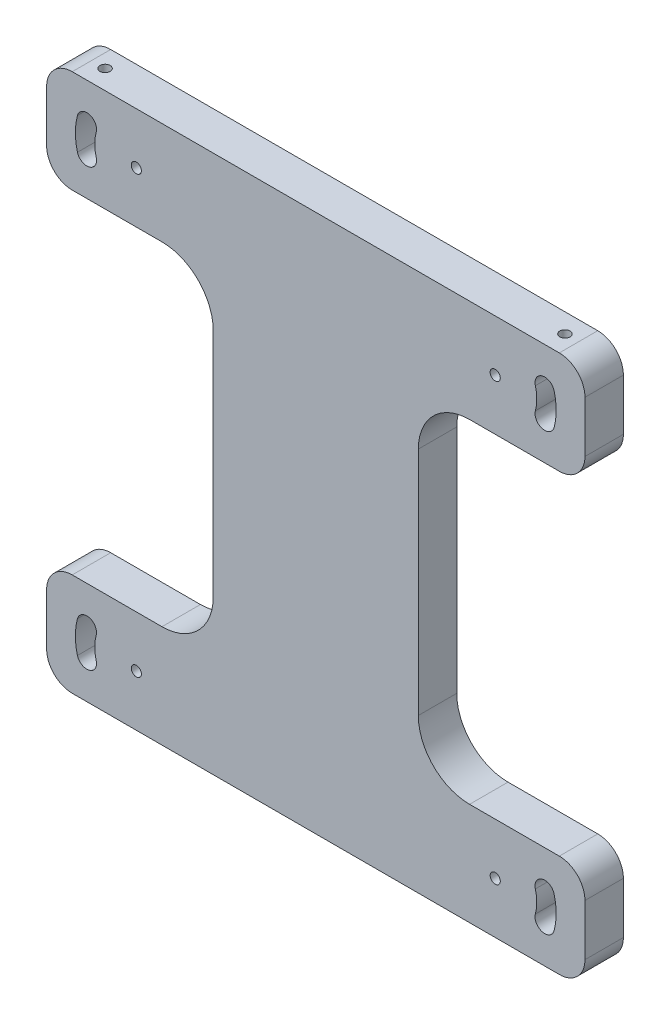
from build123d import *

# Parameters (mm, degrees)
MODEL_R             = 2.5146
BOSS_EXTRUDE1_DEPTH = 19.05
CUT_EXTRUDE1_REACH  = 439.02
SKETCH2_R           = 2.5527
CUT_EXTRUDE2_REACH  = 439.02
SKETCH3_R           = 2.5527


with BuildPart() as part:
    # Model → Boss-Extrude1 (new body)
    with BuildSketch(Plane.XY):
        with BuildLine():
            Line((332.980192528, 413.072749717), (91.680192525, 413.072749717))
            ThreePointArc((91.680192525, 413.072749717), (82.699936404, 409.353005838), (78.980192525, 400.372749717))
            Line((78.980192525, 400.372749717), (78.980192525, 374.972749717))
            ThreePointArc((78.980192525, 374.972749717), (82.699936404, 365.992493596), (91.680192525, 362.272749717))
            Line((91.680192525, 362.272749717), (136.130192525, 362.272749717))
            ThreePointArc((136.130192525, 362.272749717), (154.090704768, 354.833261959), (161.530192525, 336.872749717))
            Line((161.530192525, 336.872749717), (161.530192525, 222.572749717))
            ThreePointArc((161.530192525, 222.572749717), (154.090704768, 204.612237475), (136.130192525, 197.172749717))
            Line((136.130192525, 197.172749717), (91.680192525, 197.172749717))
            ThreePointArc((91.680192525, 197.172749717), (82.699936404, 193.453005838), (78.980192525, 184.472749717))
            Line((78.980192525, 184.472749717), (78.980192525, 159.072749717))
            ThreePointArc((78.980192525, 159.072749717), (82.699936404, 150.092493596), (91.680192525, 146.372749717))
            Line((91.680192525, 146.372749717), (332.980192528, 146.372749717))
            ThreePointArc((332.980192528, 146.372749717), (341.960448649, 150.092493596), (345.680192528, 159.072749717))
            Line((345.680192528, 159.072749717), (345.680192528, 184.472749717))
            ThreePointArc((345.680192528, 184.472749717), (341.960448648, 193.453005839), (332.980192525, 197.172749717))
            Line((332.980192525, 197.172749717), (288.530192525, 197.172749717))
            ThreePointArc((288.530192525, 197.172749717), (270.569680283, 204.612237475), (263.130192525, 222.572749717))
            Line((263.130192525, 222.572749717), (263.130192525, 336.872749717))
            ThreePointArc((263.130192525, 336.872749717), (270.569680284, 354.83326196), (288.530192528, 362.272749717))
            Line((288.530192528, 362.272749717), (332.980192528, 362.272749717))
            ThreePointArc((332.980192528, 362.272749717), (341.960448649, 365.992493596), (345.680192528, 374.972749717))
            Line((345.680192528, 374.972749717), (345.680192528, 400.372749717))
            ThreePointArc((345.680192528, 400.372749717), (341.960448649, 409.353005838), (332.980192528, 413.072749717))
        make_face()
        with Locations(Location((123.430192525, 387.672749717, 0), (0, 0, 180))):
            Circle(MODEL_R, mode=Mode.SUBTRACT)
        with Locations(Location((301.230192525, 387.672749717, 0), (0, 0, 180))):
            Circle(MODEL_R, mode=Mode.SUBTRACT)
        with Locations(Location((123.430192525, 171.772749717, 0), (0, 0, 180))):
            Circle(MODEL_R, mode=Mode.SUBTRACT)
        with Locations(Location((301.230192525, 171.772749717, 0), (0, 0, 180))):
            Circle(MODEL_R, mode=Mode.SUBTRACT)
        with BuildLine():
            ThreePointArc((330.402277638, 163.888053974), (331.440317525, 171.772749717), (330.402277638, 179.657445459))
            ThreePointArc((330.402277638, 179.657445459), (324.511101714, 183.058717465), (321.109829708, 177.167541541))
            ThreePointArc((321.109829708, 177.167541541), (321.820067525, 171.772749717), (321.109829708, 166.377957893))
            ThreePointArc((321.109829708, 166.377957893), (324.511101714, 160.486781969), (330.402277638, 163.888053974))
        make_face(mode=Mode.SUBTRACT)
        with BuildLine():
            ThreePointArc((103.550555343, 177.167541541), (102.840317525, 171.772749717), (103.550555343, 166.377957893))
            ThreePointArc((103.550555343, 166.377957893), (100.149283337, 160.486781969), (94.258107413, 163.888053974))
            ThreePointArc((94.258107413, 163.888053974), (93.220067525, 171.772749717), (94.258107413, 179.657445459))
            ThreePointArc((94.258107413, 179.657445459), (100.149283337, 183.058717465), (103.550555343, 177.167541541))
        make_face(mode=Mode.SUBTRACT)
        with BuildLine():
            ThreePointArc((321.109829708, 382.277957893), (321.820067525, 387.672749717), (321.109829708, 393.067541541))
            ThreePointArc((321.109829708, 393.067541541), (324.511101714, 398.958717465), (330.402277638, 395.557445459))
            ThreePointArc((330.402277638, 395.557445459), (331.440317525, 387.672749717), (330.402277638, 379.788053974))
            ThreePointArc((330.402277638, 379.788053974), (324.511101714, 376.386781969), (321.109829708, 382.277957893))
        make_face(mode=Mode.SUBTRACT)
        with BuildLine():
            ThreePointArc((94.258107413, 395.557445459), (93.220067525, 387.672749717), (94.258107413, 379.788053974))
            ThreePointArc((94.258107413, 379.788053974), (100.149283337, 376.386781969), (103.550555343, 382.277957893))
            ThreePointArc((103.550555343, 382.277957893), (102.840317525, 387.672749717), (103.550555343, 393.067541541))
            ThreePointArc((103.550555343, 393.067541541), (100.149283337, 398.958717465), (94.258107413, 395.557445459))
        make_face(mode=Mode.SUBTRACT)
    extrude(amount=BOSS_EXTRUDE1_DEPTH)

    # Sketch2 → Cut-Extrude1 (cut, up to next)
    with BuildSketch(Plane(origin=(0, 413.072749717, 0), x_dir=(1, 0, 0), z_dir=(0, 1, 0)), mode=Mode.PRIVATE) as cut_extrude1_sk1:
        with Locations(Location((98.411192525, -9.525, 0), (0, 0, 180))):
            Circle(SKETCH2_R)
    cut_extrude1_tool1 = extrude(cut_extrude1_sk1.sketch, amount=-CUT_EXTRUDE1_REACH, mode=Mode.PRIVATE) & part.part
    # Sketch2 → Cut-Extrude1 (cut, up to next)
    with BuildSketch(Plane(origin=(0, 413.072749717, 0), x_dir=(1, 0, 0), z_dir=(0, 1, 0)), mode=Mode.PRIVATE) as cut_extrude1_sk2:
        with Locations(Location((326.249192528, -9.525, 0), (0, 0, 180))):
            Circle(SKETCH2_R)
    cut_extrude1_tool2 = extrude(cut_extrude1_sk2.sketch, amount=-CUT_EXTRUDE1_REACH, mode=Mode.PRIVATE) & part.part
    add(cut_extrude1_tool1.solids().sort_by_distance((98.411193, 413.07275, 9.525))[0], mode=Mode.SUBTRACT)
    add(cut_extrude1_tool2.solids().sort_by_distance((326.249193, 413.07275, 9.525))[0], mode=Mode.SUBTRACT)

    # Sketch3 → Cut-Extrude2 (cut, up to next)
    with BuildSketch(Plane.XZ.offset(-146.372749717), mode=Mode.PRIVATE) as cut_extrude2_sk1:
        with Locations(Location((98.411192525, 9.525, 0), (0, 0, 180))):
            Circle(SKETCH3_R)
    cut_extrude2_tool1 = extrude(cut_extrude2_sk1.sketch, amount=-CUT_EXTRUDE2_REACH, mode=Mode.PRIVATE) & part.part
    # Sketch3 → Cut-Extrude2 (cut, up to next)
    with BuildSketch(Plane.XZ.offset(-146.372749717), mode=Mode.PRIVATE) as cut_extrude2_sk2:
        with Locations(Location((326.249192528, 9.525, 0), (0, 0, 180))):
            Circle(SKETCH3_R)
    cut_extrude2_tool2 = extrude(cut_extrude2_sk2.sketch, amount=-CUT_EXTRUDE2_REACH, mode=Mode.PRIVATE) & part.part
    add(cut_extrude2_tool1.solids().sort_by_distance((98.411193, 146.37275, 9.525))[0], mode=Mode.SUBTRACT)
    add(cut_extrude2_tool2.solids().sort_by_distance((326.249193, 146.37275, 9.525))[0], mode=Mode.SUBTRACT)


solid = part.part
